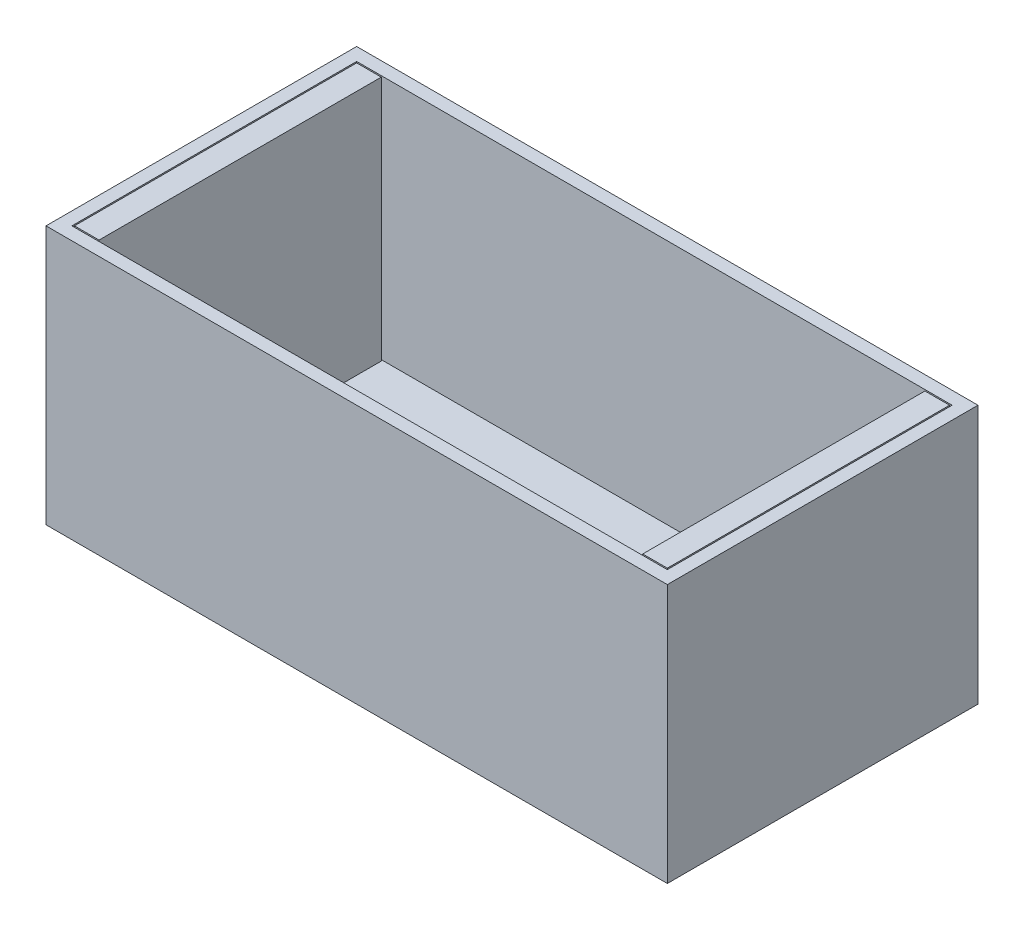
from build123d import *

# Parameters (mm, degrees)
SKETCH1_W           = 609.6
SKETCH1_H           = 304.8
BOSS_EXTRUDE1_DEPTH = 254
SHELL1_T            = -12.7
SKETCH2_W           = 24.13
SKETCH2_H           = 276.86
BOSS_EXTRUDE3_DEPTH = 241.3


with BuildPart() as part:
    # Sketch1 → Boss-Extrude1 (new body)
    with BuildSketch(Plane(origin=(0, 0, 0), x_dir=(1, 0, 0), z_dir=(0, 1, 0))):
        Rectangle(SKETCH1_W, SKETCH1_H)
    extrude(amount=BOSS_EXTRUDE1_DEPTH)

    # Shell1
    shell1_openings = [part.faces().sort_by_distance(p)[0] for p in [
        (0, 254, 0),
    ]]
    offset(amount=SHELL1_T, openings=shell1_openings, kind=Kind.INTERSECTION)

    # Sketch2 → Boss-Extrude3 (add)
    with BuildSketch(Plane(origin=(0, 12.7, 0), x_dir=(1, 0, 0), z_dir=(0, 1, 0))):
        with Locations((-278.765, 0)):
            Rectangle(SKETCH2_W, SKETCH2_H)
    boss_extrude3 = extrude(amount=BOSS_EXTRUDE3_DEPTH)

    # Mirror1: Boss-Extrude3 across plane
    add(boss_extrude3.mirror(Plane(origin=(0, 0, 0), x_dir=(0, 0, 1), z_dir=(1, 0, 0))))


solid = part.part
